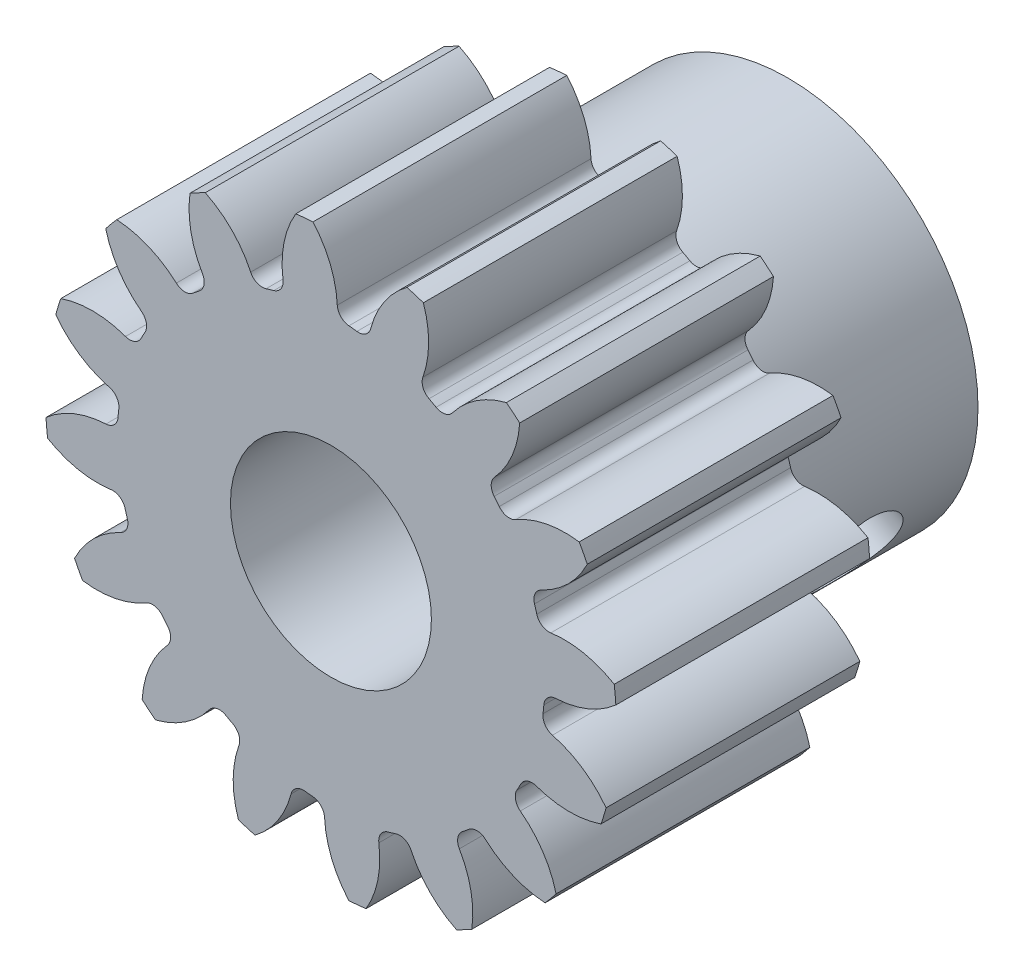
from build123d import *

# Parameters (mm, degrees)
SKETCH3_R         = 7.14375
GEARBODY_DEPTH    = 6.35
TOOTHCUT_DEPTH    = 12.932679
CIRPATTERN1_COUNT = 16
HUB1DIA_R         = 4.7625
HUB1_DEPTH        = 5.080000076
BOREDIA_R         = 2.514599986
BORE_DEPTH        = 12700
SS1HUB1_D         = 2.27584
SS1HUB1_DEPTH     = 4.7625
SS1HUB1_TIP       = 0.683731316


with BuildPart() as part:
    # Sketch3 → gearBody (new body)
    with BuildSketch(Plane.XY):
        Circle(SKETCH3_R)
    extrude(amount=GEARBODY_DEPTH)

    # Sketch2 → toothCut (cut, through all)
    with BuildSketch(Plane.XY):
        with BuildLine():
            ThreePointArc((5.306900665, -0.651157603), (5.318245312, -0.550879014), (5.327695278, -0.450404168))
            ThreePointArc((5.327695278, -0.450404168), (5.423940856, -0.248073769), (5.629653426, -0.159286719))
            ThreePointArc((5.629653426, -0.159286719), (6.706703242, 0.149132804), (7.533202253, 0.905478157))
            ThreePointArc((7.533202253, 0.905478157), (7.547045935, -0.781744537), (7.187671981, -2.430308285))
            ThreePointArc((7.187671981, -2.430308285), (6.533745871, -1.520616276), (5.542778599, -0.997985647))
            ThreePointArc((5.542778599, -0.997985647), (5.359631891, -0.868919444), (5.306900665, -0.651157603))
        make_face()
    toothcut = extrude(amount=TOOTHCUT_DEPTH, mode=Mode.SUBTRACT)

    # CirPattern1: toothCut ×16 about axis
    cirpattern1_axis = Axis((0, 0, 6.35), (0, 0, -1))
    for i in range(1, CIRPATTERN1_COUNT):
        add(toothcut.rotate(cirpattern1_axis, i * 360 / CIRPATTERN1_COUNT), mode=Mode.SUBTRACT)

    # hub1Dia → hub1 (add)
    with BuildSketch(Plane(origin=(0, 0, 0), x_dir=(-1, 0, 0), z_dir=(0, 0, -1))):
        Circle(HUB1DIA_R)
    extrude(amount=HUB1_DEPTH)

    # boreDia → bore (cut, symmetric)
    with BuildSketch(Plane.XY):
        Circle(BOREDIA_R)
    extrude(amount=BORE_DEPTH, both=True, mode=Mode.SUBTRACT)

    # ss1Hub1
    with Locations(Plane(origin=(4.188781818, -2.266167057, -2.540000038), x_dir=(0.475835602514, 0.879534240027, 0), z_dir=(0.879534240027, -0.475835602514, 0))):
        with Locations((0, 0)):
            Hole(SS1HUB1_D / 2, depth=SS1HUB1_DEPTH)
            with Locations((0, 0, -(SS1HUB1_DEPTH + SS1HUB1_TIP / 2))):  # 118° drill point
                Cone(0, SS1HUB1_D / 2, SS1HUB1_TIP, mode=Mode.SUBTRACT)


solid = part.part
